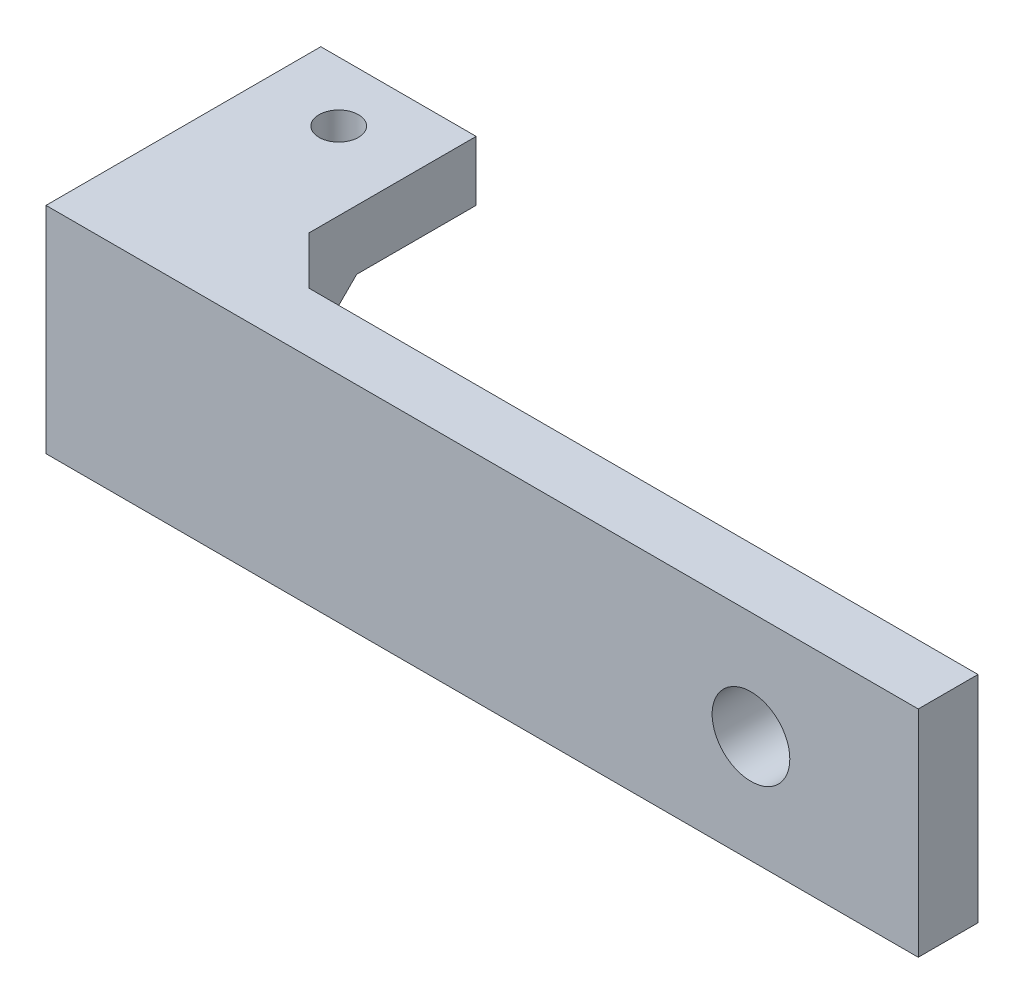
from build123d import *

# Parameters (mm, degrees)
IZIM1_R                          = 3.25
Y_KSEKLIK_EKSTR_ZYON1_DEPTH      = 5
Y_KSEKLIK_EKSTR_ZYON2_DEPTH      = 5
Y_KSEKLIK_EKSTR_ZYON2_DEPTH_BACK = 5
IZIM2_W                          = 13
IZIM2_H                          = 18
IZIM3_W                          = 13
IZIM3_H                          = 5
Y_KSEKLIK_EKSTR_ZYON3_DEPTH      = 13
PAH1_SIZE                        = 3
PAH2_SIZE                        = 4
KES_EKSTR_ZYON1_DEPTH            = 23
IZIM5_R                          = 1.65
KES_EKSTR_ZYON2_DEPTH            = 10


with BuildPart() as part:
    # Çizim1 → Yükseklik-Ekstrüzyon1 (new body)
    with BuildSketch(Plane.XY):
        Polygon((-60, 1.849304372), (0, 1.849304372), (0, 3.698608744), (0, 19.849304372), (-60, 19.849304372), align=None)
        with Locations((-14, 10.849304372)):
            Circle(IZIM1_R, mode=Mode.SUBTRACT)
    extrude(amount=Y_KSEKLIK_EKSTR_ZYON1_DEPTH)

    # Çizim2 → Yükseklik-Ekstrüzyon2 (add, two sides: drawn at the far end of the back side and taken through both)
    with BuildSketch(Plane(origin=(0, 0, 0), x_dir=(-1, 0, 0), z_dir=(0, 0, -1)).offset(-Y_KSEKLIK_EKSTR_ZYON2_DEPTH_BACK)):
        with Locations((66.5, 10.849304372)):
            Rectangle(IZIM2_W, IZIM2_H)
    extrude(amount=Y_KSEKLIK_EKSTR_ZYON2_DEPTH + Y_KSEKLIK_EKSTR_ZYON2_DEPTH_BACK)

    # Çizim3 → Yükseklik-Ekstrüzyon3 (add)
    with BuildSketch(Plane.ZY.offset(73)):
        with Locations((-11.5, 17.349304372)):
            Rectangle(IZIM3_W, IZIM3_H)
    extrude(amount=-Y_KSEKLIK_EKSTR_ZYON3_DEPTH)

    # Pah1
    pah1_edges = [part.edges().sort_by_distance(p)[0] for p in [
        (-66.5, 14.849304372, -5),
    ]]
    chamfer(pah1_edges, length=PAH1_SIZE)

    # Pah2
    pah2_edges = [part.edges().sort_by_distance(p)[0] for p in [
        (-60, 10.849304372, 0),
    ]]
    chamfer(pah2_edges, length=PAH2_SIZE)

    # Çizim4 → Kes-Ekstrüzyon1 (cut)
    with BuildSketch(Plane.ZY.offset(73)):
        Polygon((-5, 11.849304372), (0, 1.849304372), (-5, 1.849304372), align=None)
    extrude(amount=-KES_EKSTR_ZYON1_DEPTH, mode=Mode.SUBTRACT)

    # Çizim5 → Kes-Ekstrüzyon2 (cut)
    with BuildSketch(Plane.XZ.offset(-14.849304372)):
        with Locations(Location((-66.5, -13, 0), (0, 0, 270))):
            Circle(IZIM5_R)
    extrude(amount=-KES_EKSTR_ZYON2_DEPTH, mode=Mode.SUBTRACT)


solid = part.part
